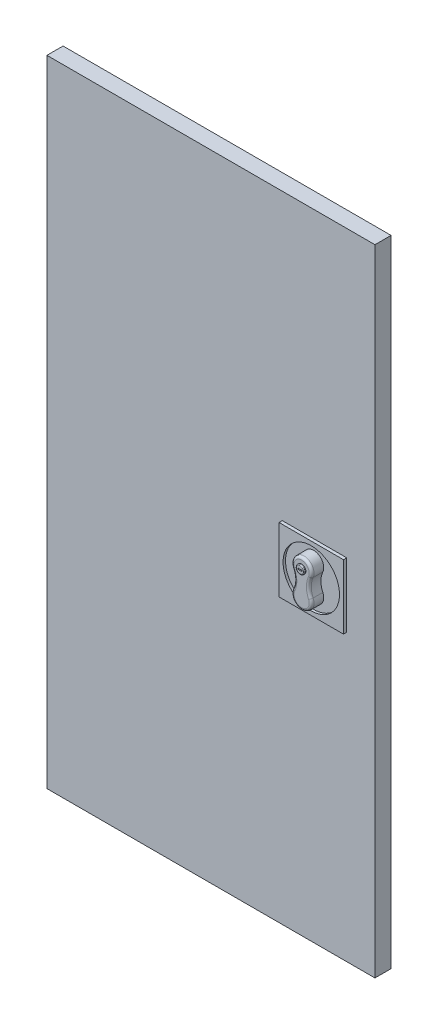
from build123d import *

# Parameters (mm, degrees)
SKETCH1_W                 = 407
SKETCH1_H                 = 788
BOSS_EXTRUDE1_DEPTH       = 10
SHELL1_T                  = -1.5
SKETCH2_W                 = 80
SKETCH2_H                 = 80
BOSS_EXTRUDE2_DEPTH       = 4
SKETCH3_R                 = 35
CUT_EXTRUDE1_DEPTH        = 3
BOSS_EXTRUDE3_DEPTH       = 15
SKETCH5_R                 = 5.284188489
BOSS_EXTRUDE4_DEPTH       = 2
FILLET1_R                 = 3
FILLET2_R                 = 1
SKETCH6_W                 = 5.396205122
SKETCH6_H                 = 1.259856044
CUT_EXTRUDE2_DEPTH        = 5
BOSS_EXTRUDE5_START       = -71.5
SKETCH7_R                 = 6
SKETCH7_R_2               = 2
BOSS_EXTRUDE5_DEPTH       = 12.5
MIRROR2_START             = -71.5
MIRROR2_COPY_1_SKETCH_R   = 6
MIRROR2_COPY_1_SKETCH_R_2 = 2
MIRROR2_COPY_1_DEPTH      = 12.5


with BuildPart() as part:
    # Sketch1 → Boss-Extrude1 (new, symmetric)
    with BuildSketch(Plane.XY):
        Rectangle(SKETCH1_W, SKETCH1_H)
    extrude(amount=BOSS_EXTRUDE1_DEPTH, both=True)

    # Shell1
    shell1_openings = [part.faces().sort_by_distance(p)[0] for p in [
        (0, 0, -10),
    ]]
    offset(amount=SHELL1_T, openings=shell1_openings, kind=Kind.INTERSECTION)

    # Sketch2 → Boss-Extrude2 (add)
    with BuildSketch(Plane.XY.offset(10)):
        with Locations((128.5, 0)):
            Rectangle(SKETCH2_W, SKETCH2_H)
    extrude(amount=BOSS_EXTRUDE2_DEPTH)

    # Sketch3 → Cut-Extrude1 (cut)
    with BuildSketch(Plane.XY.offset(14)):
        with Locations((128.5, 0)):
            Circle(SKETCH3_R)
    extrude(amount=-CUT_EXTRUDE1_DEPTH, mode=Mode.SUBTRACT)

    # Sketch4 → Boss-Extrude3 (add)
    with BuildSketch(Plane.XY.offset(11)):
        with BuildLine():
            ThreePointArc((139.828046269, 11.018836293), (128.5, 28.547480442), (117.171953731, 11.018836293))
            ThreePointArc((117.171953731, 11.018836293), (119.53963249, 0), (117.171953731, -11.018836293))
            ThreePointArc((117.171953731, -11.018836293), (128.5, -28.547480442), (139.828046269, -11.018836293))
            ThreePointArc((139.828046269, -11.018836293), (137.46036751, 0), (139.828046269, 11.018836293))
        make_face()
    extrude(amount=BOSS_EXTRUDE3_DEPTH)

    # Sketch5 → Boss-Extrude4 (add)
    with BuildSketch(Plane.XY.offset(26)):
        with Locations((128.5, 16.12273172)):
            Circle(SKETCH5_R)
    extrude(amount=BOSS_EXTRUDE4_DEPTH)

    # Fillet1
    fillet1_edges = [part.edges().sort_by_distance(p)[0] for p in [
        (137.46036751, 0, 26),
        (128.5, 28.547480442, 26),
        (119.53963249, 0, 26),
        (128.5, -28.547480442, 26),
    ]]
    fillet(fillet1_edges, radius=FILLET1_R)

    # Fillet2
    fillet2_edges = [part.edges().sort_by_distance(p)[0] for p in [
        (123.215811511, 16.12273172, 28),
    ]]
    fillet(fillet2_edges, radius=FILLET2_R)

    # Sketch6 → Cut-Extrude2 (cut)
    with BuildSketch(Plane.XY.offset(28)):
        with Locations((128.5, 16.12273172)):
            Rectangle(SKETCH6_W, SKETCH6_H)
    extrude(amount=-CUT_EXTRUDE2_DEPTH, mode=Mode.SUBTRACT)

    # Sketch7 → Boss-Extrude5 (add)
    with BuildSketch(Plane(origin=(0, 394, 0), x_dir=(1, 0, 0), z_dir=(0, 1, 0)).offset(BOSS_EXTRUDE5_START)):
        with Locations((-193.5, -3)):
            Circle(SKETCH7_R)
        with Locations(Location((-193.5, -3, 0), (0, 0, 270))):
            Circle(SKETCH7_R_2, mode=Mode.SUBTRACT)
    boss_extrude5 = extrude(amount=-BOSS_EXTRUDE5_DEPTH)

    # Mirror1: Boss-Extrude5 across plane
    add(boss_extrude5.mirror(Plane(origin=(0, 292, 0), x_dir=(0, 0, 1), z_dir=(0, -1, 0))))

    # Mirror2: Boss-Extrude5 across plane
    add(boss_extrude5.mirror(Plane.ZX))

    # Mirror2 copy 1 sketch → Mirror2 copy 1 (add)
    with BuildSketch(Plane(origin=(0, -190, 0), x_dir=(1, 0, 0), z_dir=(0, 1, 0)).offset(MIRROR2_START)):
        with Locations((-193.5, -3)):
            Circle(MIRROR2_COPY_1_SKETCH_R)
        with Locations(Location((-193.5, -3, 0), (0, 0, 270))):
            Circle(MIRROR2_COPY_1_SKETCH_R_2, mode=Mode.SUBTRACT)
    extrude(amount=-MIRROR2_COPY_1_DEPTH)


solid = part.part
